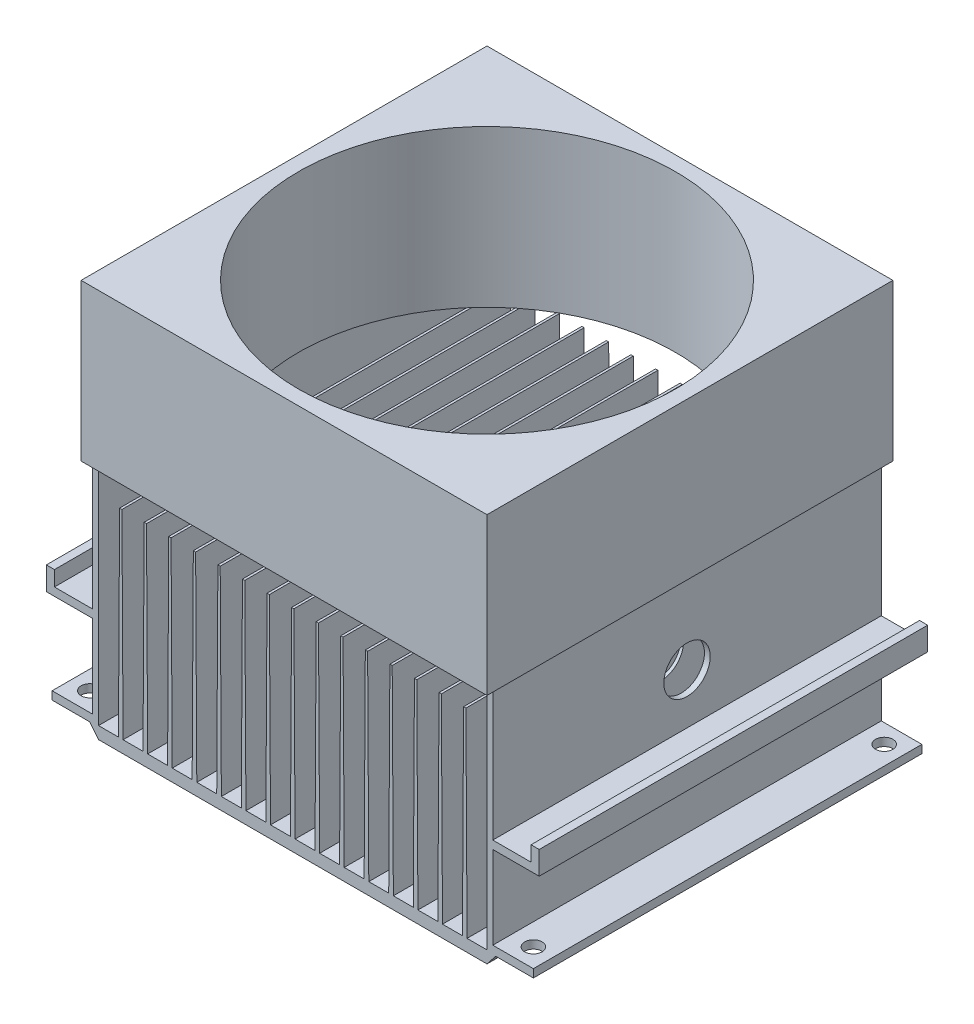
from build123d import *

# Parameters (mm, degrees)
HEATSINK_DEPTH                    = 67
SKETCH3_R                         = 32.5
FAN_DEPTH                         = 27
SKETCH4_R                         = 1.5
MOUNTING_HOLES_CUT_EXTRUDE1_DEPTH = 1.4
U_ARM_SHAFT_CUT_EXTRUDE2_REACH    = 125.803
SKETCH6_R                         = 4


with BuildPart() as part:
    # Sketch1 → Heatsink (new body)
    with BuildSketch(Plane.XY):
        Polygon((-33.5, 0), (33.5, 0), (35, 1.9), (41.5, 1.9), (41.5, 3.3), (34.5, 3.3), (34.5, 17.6), (42.5, 17.6), (42.5, 21.6), (41.1, 21.6), (41.1, 19), (34.5, 19), (34.5, 41.6), (33.5, 41.6), (33.5, 2.1), (30.0625, 2.1), (29.8625, 36.4), (29.4625, 36.4), (29.2625, 2.1), (25.825, 2.1), (25.625, 36.4), (25.225, 36.4), (25.025, 2.1), (21.5875, 2.1), (21.3875, 36.4), (20.9875, 36.4), (20.7875, 2.1), (17.35, 2.1), (17.15, 36.4), (16.75, 36.4), (16.55, 2.1), (13.1125, 2.1), (12.9125, 36.4), (12.5125, 36.4), (12.3125, 2.1), (8.875, 2.1), (8.675, 36.4), (8.275, 36.4), (8.075, 2.1), (4.6375, 2.1), (4.4375, 36.4), (4.0375, 36.4), (3.8375, 2.1), (0.4, 2.1), (0.2, 36.4), (-0.2, 36.4), (-0.4, 2.1), (-3.8375, 2.1), (-4.0375, 36.4), (-4.4375, 36.4), (-4.6375, 2.1), (-8.075, 2.1), (-8.275, 36.4), (-8.675, 36.4), (-8.875, 2.1), (-12.3125, 2.1), (-12.5125, 36.4), (-12.9125, 36.4), (-13.1125, 2.1), (-16.55, 2.1), (-16.75, 36.4), (-17.15, 36.4), (-17.35, 2.1), (-20.7875, 2.1), (-20.9875, 36.4), (-21.3875, 36.4), (-21.5875, 2.1), (-25.025, 2.1), (-25.225, 36.4), (-25.625, 36.4), (-25.825, 2.1), (-29.2625, 2.1), (-29.4625, 36.4), (-29.8625, 36.4), (-30.0625, 2.1), (-33.5, 2.1), (-33.5, 41.6), (-34.5, 41.6), (-34.5, 19), (-41.1, 19), (-41.1, 21.6), (-42.5, 21.6), (-42.5, 17.6), (-34.5, 17.6), (-34.5, 3.3), (-41.5, 3.3), (-41.5, 1.9), (-35, 1.9), align=None)
    extrude(amount=-HEATSINK_DEPTH)

    # Sketch4 → Mounting Holes Cut-Extrude1 (cut)
    with BuildSketch(Plane.XZ.offset(-1.9)):
        with Locations(Location((38.25, -3.25, 0), (0, 0, 270))):
            Circle(SKETCH4_R)
        with Locations(Location((-38.25, -3.25, 0), (0, 0, 90))):
            Circle(SKETCH4_R)
        with Locations(Location((38.25, -63.75, 0), (0, 0, 90))):
            Circle(SKETCH4_R)
        with Locations(Location((-38.25, -63.75, 0), (0, 0, 270))):
            Circle(SKETCH4_R)
    extrude(amount=-MOUNTING_HOLES_CUT_EXTRUDE1_DEPTH, mode=Mode.SUBTRACT)

    # U-Arm Shaft Cut-Extrude2: up to this face of the body (flat: up to its plane)
    u_arm_shaft_cut_extrude2_end = Plane(part.part.faces().sort_by_distance((-34.5, 30.3, -33.5))[0])
    # Sketch6 → U-Arm Shaft Cut-Extrude2 (cut, up to the picked face)
    with BuildSketch(Plane(origin=(34.5, 0, 0), x_dir=(0, 0, -1), z_dir=(1, 0, 0)), mode=Mode.PRIVATE) as u_arm_shaft_cut_extrude2_sk1:
        with Locations((33.5, 27.7)):
            Circle(SKETCH6_R)
    u_arm_shaft_cut_extrude2_tool1 = split(extrude(u_arm_shaft_cut_extrude2_sk1.sketch, amount=-U_ARM_SHAFT_CUT_EXTRUDE2_REACH, mode=Mode.PRIVATE), bisect_by=u_arm_shaft_cut_extrude2_end, keep=Keep.BOTH, mode=Mode.PRIVATE)
    add(u_arm_shaft_cut_extrude2_tool1.solids().sort_by(Axis((34.5, 27.7, -33.5), (-1, 0, 0)))[0], mode=Mode.SUBTRACT)


with BuildPart() as body_2:
    # Sketch3 → Fan (new body)
    with BuildSketch(Plane(origin=(0, 41.6, 0), x_dir=(1, 0, 0), z_dir=(0, 1, 0))):
        Polygon((-35, 68.5), (35, 68.5), (35, -1.5), (0, -1.5), (-35, -1.5), align=None)
        with Locations(Location((0, 33.5, 0), (0, 0, 270))):
            Circle(SKETCH3_R, mode=Mode.SUBTRACT)
    extrude(amount=FAN_DEPTH)


solid = Compound([part.part, body_2.part])
